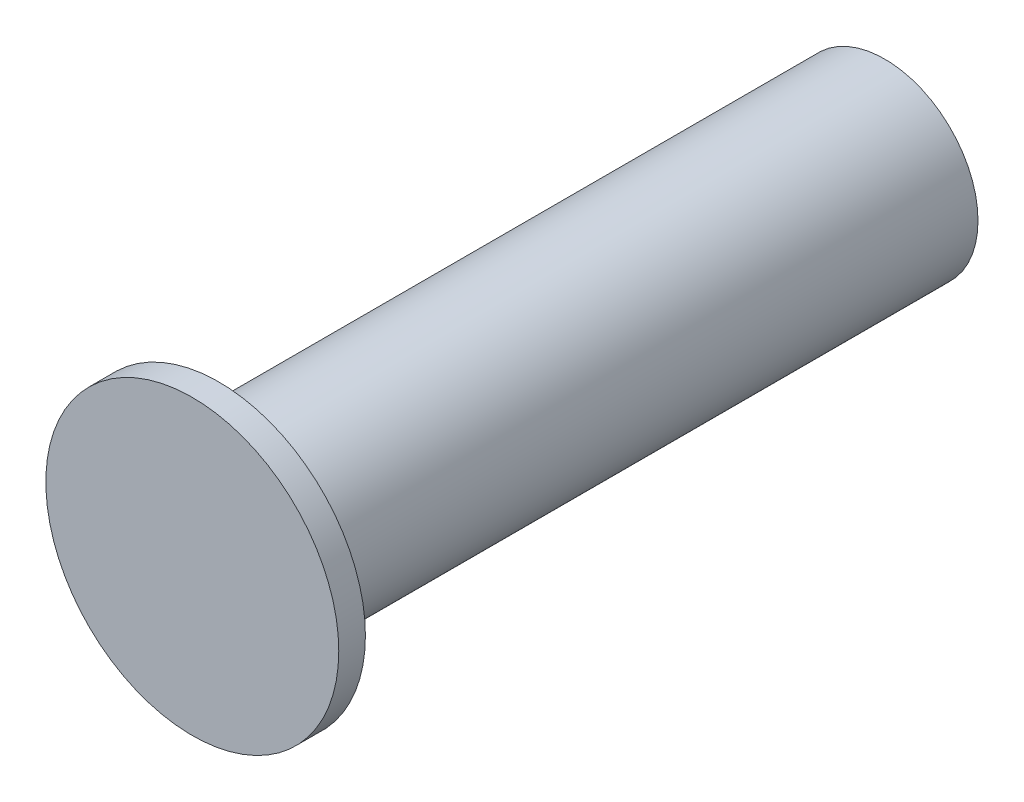
from build123d import *

# Parameters (mm, degrees)
SKETCH1_R           = 2.794
BOSS_EXTRUDE1_DEPTH = 0.508
SKETCH2_R           = 1.779520894
BOSS_EXTRUDE2_DEPTH = 12.7


with BuildPart() as part:
    # Sketch1 → Boss-Extrude1 (new body)
    with BuildSketch(Plane.XY):
        Circle(SKETCH1_R)
    extrude(amount=BOSS_EXTRUDE1_DEPTH)

    # Sketch2 → Boss-Extrude2 (add)
    with BuildSketch(Plane(origin=(0, 0, 0), x_dir=(-1, 0, 0), z_dir=(0, 0, -1))):
        with Locations(Location((0, 0, 0), (0, 0, 180))):
            Circle(SKETCH2_R)
    extrude(amount=BOSS_EXTRUDE2_DEPTH)


solid = part.part
